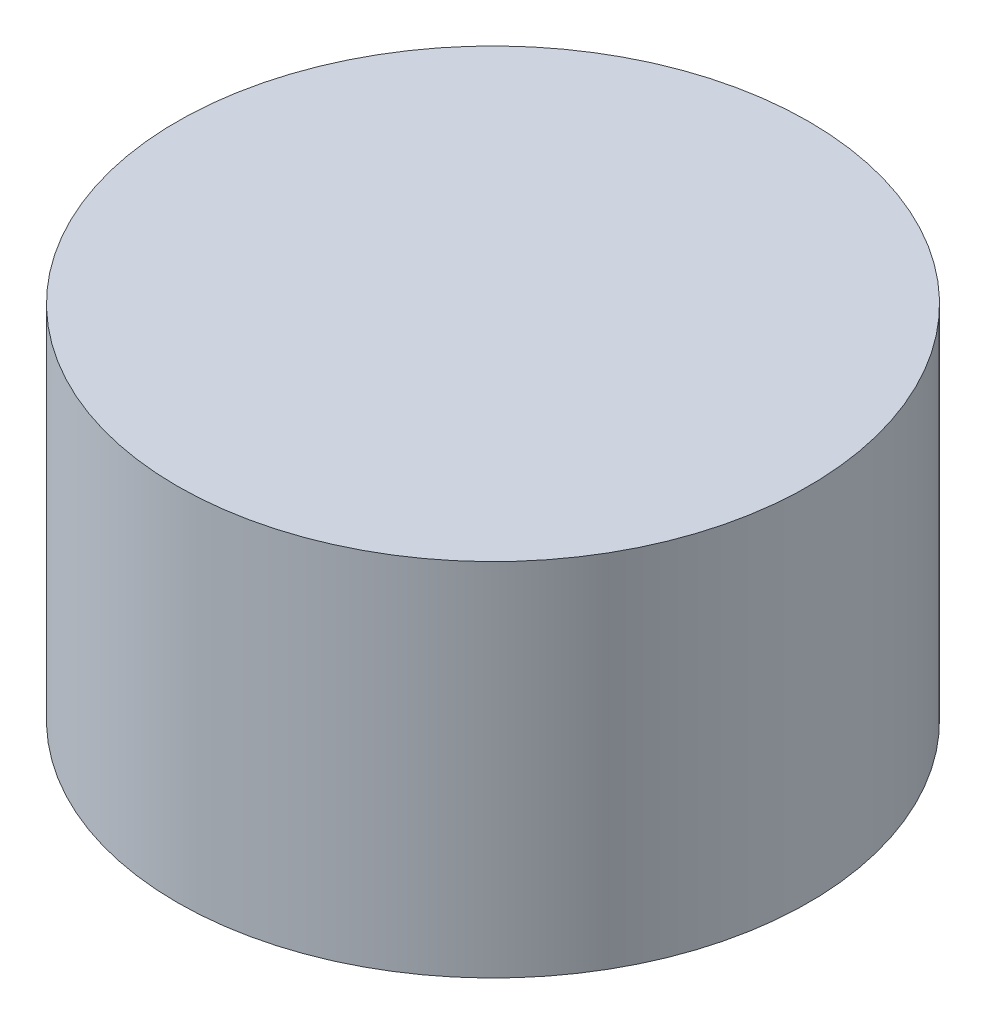
from build123d import *

# Parameters (mm, degrees)
SKETCH1_R      = 37.651114002
EXTRUDE1_DEPTH = 43


with BuildPart() as part:
    # Sketch1 → Extrude1 (new body)
    with BuildSketch(Plane(origin=(0, 0, 0), x_dir=(1, 0, 0), z_dir=(0, 1, 0))):
        with Locations(Location((0, 0, 0), (0, 0, 270))):
            Circle(SKETCH1_R)
    extrude(amount=EXTRUDE1_DEPTH)


solid = part.part
